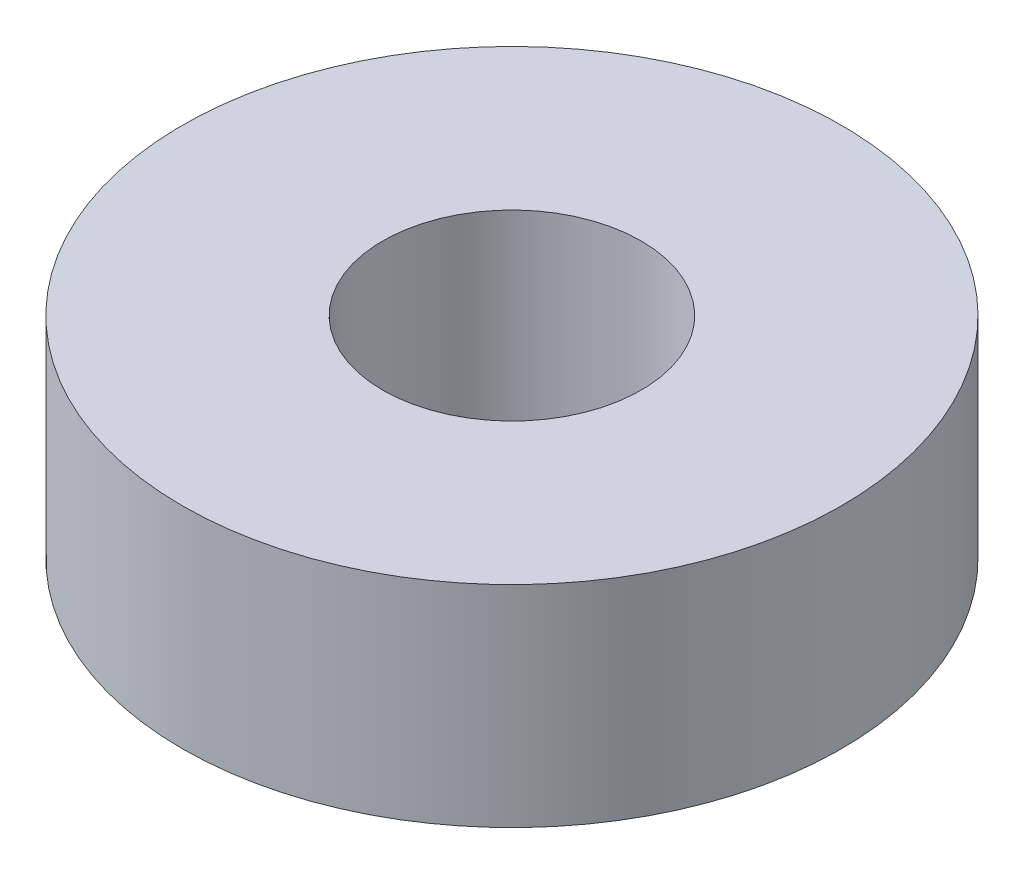
from build123d import *

# Parameters (mm, degrees)
SKETCH1_R           = 10.9625
SKETCH1_R_2         = 4.3
BOSS_EXTRUDE1_DEPTH = 7


with BuildPart() as part:
    # Sketch1 → Boss-Extrude1 (new body)
    with BuildSketch(Plane(origin=(0, 0, 0), x_dir=(1, 0, 0), z_dir=(0, 1, 0))):
        with Locations(Location((0, 0, 0), (0, 0, 270))):
            Circle(SKETCH1_R)
        with Locations(Location((0, 0, 0), (0, 0, 270))):
            Circle(SKETCH1_R_2, mode=Mode.SUBTRACT)
    extrude(amount=BOSS_EXTRUDE1_DEPTH)


solid = part.part
